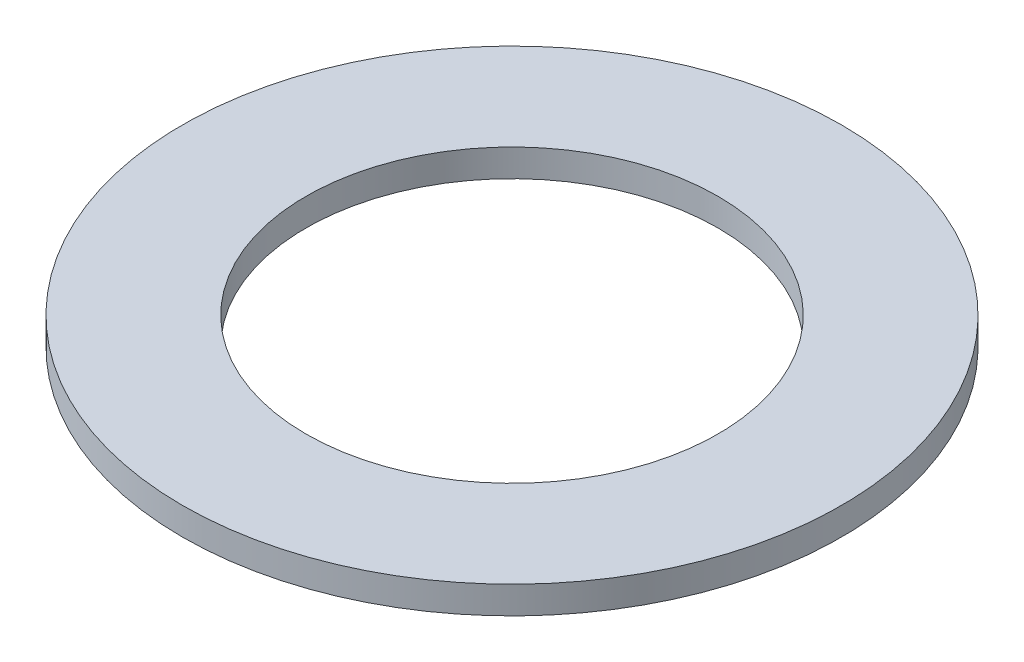
from build123d import *

# Parameters (mm, degrees)
CROQUIS1_R              = 6
CROQUIS1_R_2            = 3.75
SALIENTE_EXTRUIR1_DEPTH = 0.5


with BuildPart() as part:
    # Croquis1 → Saliente-Extruir1 (new body)
    with BuildSketch(Plane(origin=(0, 0, 0), x_dir=(1, 0, 0), z_dir=(0, 1, 0))):
        with Locations(Location((0, 0, 0), (0, 0, 270))):
            Circle(CROQUIS1_R)
        with Locations(Location((0, 0, 0), (0, 0, 270))):
            Circle(CROQUIS1_R_2, mode=Mode.SUBTRACT)
    extrude(amount=SALIENTE_EXTRUIR1_DEPTH)


solid = part.part
